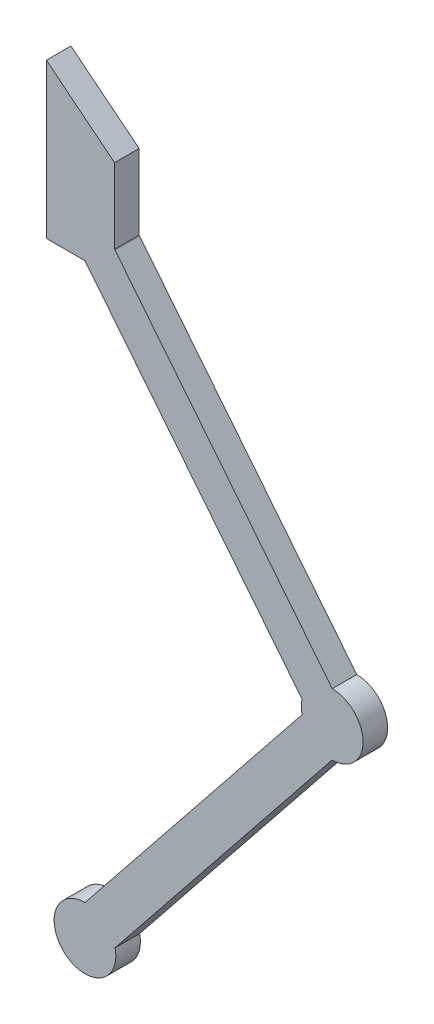
from build123d import *

# Parameters (mm, degrees)
BOSS_EXTRUDE1_DEPTH = 3.18


with BuildPart() as part:
    # Sketch1 → Boss-Extrude1 (new body)
    with BuildSketch(Plane.XY):
        with BuildLine():
            Line((0, 4), (28.125, 39.128113741))
            ThreePointArc((28.125, 39.128113741), (28.028123749, 40.003113741), (28.125, 40.878113741))
            Line((28.125, 40.878113741), (0, 76.006227482))
            Line((0, 76.006227482), (-5, 76.006227482))
            Line((-5, 76.006227482), (-5, 96.006227482))
            Line((-5, 96.006227482), (3.838218952, 88.929989064))
            Line((3.838218952, 88.929989064), (3.838218952, 79.20730223))
            Line((3.838218952, 79.20730223), (3.903123749, 79.131227482))
            Line((3.903123749, 79.131227482), (32.028123749, 44.003113741))
            ThreePointArc((32.028123749, 44.003113741), (36.028123749, 40.003113741), (32.028123749, 36.003113741))
            Line((32.028123749, 36.003113741), (3.903123749, 0.875))
            ThreePointArc((3.903123749, 0.875), (-2.5, -3.122498999), (0, 4))
        make_face()
    extrude(amount=BOSS_EXTRUDE1_DEPTH)


solid = part.part
